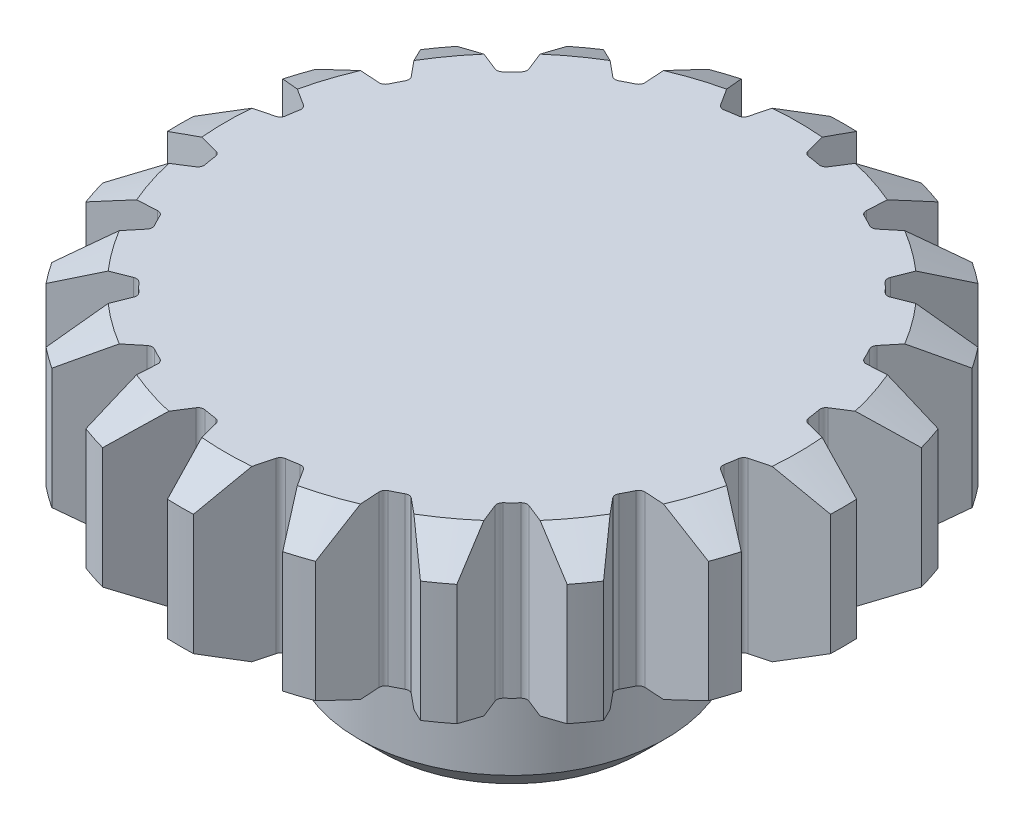
from build123d import *

# Parameters (mm, degrees)
EXTRUDE_1_DEPTH = 5.5
SKETCH_3_R      = 5
EXTRUDE_2_DEPTH = 5.5
FILLET_1_R      = 2
CHAMFER_1_SIZE  = 0.8


with BuildPart() as part:
    # 草图1 → 凸台-拉伸1 (new body)
    with BuildSketch(Plane(origin=(0, 0, 0), x_dir=(1, 0, 0), z_dir=(0, 1, 0))):
        with BuildLine():
            Line((0.974543631, 8.644214497), (0.423220814, 10.771689011))
            ThreePointArc((0.423220814, 10.771689011), (0, 10.78), (-0.423220814, 10.771689011))
            Line((-0.423220814, 10.771689011), (-0.974543631, 8.644214497))
            ThreePointArc((-0.974543631, 8.644214497), (-1.03427504, 8.546700439), (-1.138258975, 8.499117102))
            ThreePointArc((-1.138258975, 8.499117102), (-1.341425538, 8.469427521), (-1.543823006, 8.434882069))
            ThreePointArc((-1.543823006, 8.434882069), (-1.657421665, 8.44800371), (-1.744363111, 8.522287069))
            Line((-1.744363111, 8.522287069), (-2.92612805, 10.375267449))
            ThreePointArc((-2.92612805, 10.375267449), (-3.331203199, 10.252389246), (-3.731141875, 10.113702601))
            Line((-3.731141875, 10.113702601), (-3.598055254, 7.919985981))
            ThreePointArc((-3.598055254, 7.919985981), (-3.624729698, 7.808786581), (-3.708920237, 7.731399335))
            ThreePointArc((-3.708920237, 7.731399335), (-3.892968535, 7.640380945), (-4.074784835, 7.544982011))
            ThreePointArc((-4.074784835, 7.544982011), (-4.186878389, 7.522357517), (-4.292519439, 7.566138805))
            Line((-4.292519439, 7.566138805), (-5.989047112, 8.963242421))
            ThreePointArc((-5.989047112, 8.963242421), (-6.33632502, 8.721203199), (-6.673832774, 8.465716515))
            Line((-6.673832774, 8.465716515), (-5.869364158, 6.420494057))
            ThreePointArc((-5.869364158, 6.420494057), (-5.860370559, 6.306494286), (-5.916526544, 6.206878334))
            ThreePointArc((-5.916526544, 6.206878334), (-6.063440649, 6.063440649), (-6.206878334, 5.916526544))
            ThreePointArc((-6.206878334, 5.916526544), (-6.306494286, 5.860370559), (-6.420494057, 5.869364158))
            Line((-6.420494057, 5.869364158), (-8.465716515, 6.673832774))
            ThreePointArc((-8.465716515, 6.673832774), (-8.721203199, 6.33632502), (-8.963242421, 5.989047112))
            Line((-8.963242421, 5.989047112), (-7.566138805, 4.292519439))
            ThreePointArc((-7.566138805, 4.292519439), (-7.522357517, 4.186878389), (-7.544982011, 4.074784835))
            ThreePointArc((-7.544982011, 4.074784835), (-7.640380945, 3.892968535), (-7.731399335, 3.708920237))
            ThreePointArc((-7.731399335, 3.708920237), (-7.808786581, 3.624729698), (-7.919985981, 3.598055254))
            Line((-7.919985981, 3.598055254), (-10.113702601, 3.731141875))
            ThreePointArc((-10.113702601, 3.731141875), (-10.252389246, 3.331203199), (-10.375267449, 2.92612805))
            Line((-10.375267449, 2.92612805), (-8.522287069, 1.744363111))
            ThreePointArc((-8.522287069, 1.744363111), (-8.44800371, 1.657421665), (-8.434882069, 1.543823006))
            ThreePointArc((-8.434882069, 1.543823006), (-8.469427521, 1.341425538), (-8.499117102, 1.138258975))
            ThreePointArc((-8.499117102, 1.138258975), (-8.546700439, 1.03427504), (-8.644214497, 0.974543631))
            Line((-8.644214497, 0.974543631), (-10.771689011, 0.423220814))
            ThreePointArc((-10.771689011, 0.423220814), (-10.78, 0), (-10.771689011, -0.423220814))
            Line((-10.771689011, -0.423220814), (-8.644214497, -0.974543631))
            ThreePointArc((-8.644214497, -0.974543631), (-8.546700439, -1.03427504), (-8.499117102, -1.138258975))
            ThreePointArc((-8.499117102, -1.138258975), (-8.469427521, -1.341425538), (-8.434882069, -1.543823006))
            ThreePointArc((-8.434882069, -1.543823006), (-8.44800371, -1.657421665), (-8.522287069, -1.744363111))
            Line((-8.522287069, -1.744363111), (-10.375267449, -2.92612805))
            ThreePointArc((-10.375267449, -2.92612805), (-10.252389246, -3.331203199), (-10.113702601, -3.731141875))
            Line((-10.113702601, -3.731141875), (-7.919985981, -3.598055254))
            ThreePointArc((-7.919985981, -3.598055254), (-7.808786581, -3.624729698), (-7.731399335, -3.708920237))
            ThreePointArc((-7.731399335, -3.708920237), (-7.640380945, -3.892968535), (-7.544982011, -4.074784835))
            ThreePointArc((-7.544982011, -4.074784835), (-7.522357517, -4.186878389), (-7.566138805, -4.292519439))
            Line((-7.566138805, -4.292519439), (-8.963242421, -5.989047112))
            ThreePointArc((-8.963242421, -5.989047112), (-8.721203199, -6.33632502), (-8.465716515, -6.673832774))
            Line((-8.465716515, -6.673832774), (-6.420494057, -5.869364158))
            ThreePointArc((-6.420494057, -5.869364158), (-6.306494286, -5.860370559), (-6.206878334, -5.916526544))
            ThreePointArc((-6.206878334, -5.916526544), (-6.063440649, -6.063440649), (-5.916526544, -6.206878334))
            ThreePointArc((-5.916526544, -6.206878334), (-5.860370559, -6.306494286), (-5.869364158, -6.420494057))
            Line((-5.869364158, -6.420494057), (-6.673832774, -8.465716515))
            ThreePointArc((-6.673832774, -8.465716515), (-6.33632502, -8.721203199), (-5.989047112, -8.963242421))
            Line((-5.989047112, -8.963242421), (-4.292519439, -7.566138805))
            ThreePointArc((-4.292519439, -7.566138805), (-4.186878389, -7.522357517), (-4.074784835, -7.544982011))
            ThreePointArc((-4.074784835, -7.544982011), (-3.892968535, -7.640380945), (-3.708920237, -7.731399335))
            ThreePointArc((-3.708920237, -7.731399335), (-3.624729698, -7.808786581), (-3.598055254, -7.919985981))
            Line((-3.598055254, -7.919985981), (-3.731141875, -10.113702601))
            ThreePointArc((-3.731141875, -10.113702601), (-3.331203199, -10.252389246), (-2.92612805, -10.375267449))
            Line((-2.92612805, -10.375267449), (-1.744363111, -8.522287069))
            ThreePointArc((-1.744363111, -8.522287069), (-1.657421665, -8.44800371), (-1.543823006, -8.434882069))
            ThreePointArc((-1.543823006, -8.434882069), (-1.341425538, -8.469427521), (-1.138258975, -8.499117102))
            ThreePointArc((-1.138258975, -8.499117102), (-1.03427504, -8.546700439), (-0.974543631, -8.644214497))
            Line((-0.974543631, -8.644214497), (-0.423220814, -10.771689011))
            ThreePointArc((-0.423220814, -10.771689011), (0, -10.78), (0.423220814, -10.771689011))
            Line((0.423220814, -10.771689011), (0.974543631, -8.644214497))
            ThreePointArc((0.974543631, -8.644214497), (1.03427504, -8.546700439), (1.138258975, -8.499117102))
            ThreePointArc((1.138258975, -8.499117102), (1.341425538, -8.469427521), (1.543823006, -8.434882069))
            ThreePointArc((1.543823006, -8.434882069), (1.657421665, -8.44800371), (1.744363111, -8.522287069))
            Line((1.744363111, -8.522287069), (2.92612805, -10.375267449))
            ThreePointArc((2.92612805, -10.375267449), (3.331203199, -10.252389246), (3.731141875, -10.113702601))
            Line((3.731141875, -10.113702601), (3.598055254, -7.919985981))
            ThreePointArc((3.598055254, -7.919985981), (3.624729698, -7.808786581), (3.708920237, -7.731399335))
            ThreePointArc((3.708920237, -7.731399335), (3.892968535, -7.640380945), (4.074784835, -7.544982011))
            ThreePointArc((4.074784835, -7.544982011), (4.186878389, -7.522357517), (4.292519439, -7.566138805))
            Line((4.292519439, -7.566138805), (5.989047112, -8.963242421))
            ThreePointArc((5.989047112, -8.963242421), (6.33632502, -8.721203199), (6.673832774, -8.465716515))
            Line((6.673832774, -8.465716515), (5.869364158, -6.420494057))
            ThreePointArc((5.869364158, -6.420494057), (5.860370559, -6.306494286), (5.916526544, -6.206878334))
            ThreePointArc((5.916526544, -6.206878334), (6.063440649, -6.063440649), (6.206878334, -5.916526544))
            ThreePointArc((6.206878334, -5.916526544), (6.306494286, -5.860370559), (6.420494057, -5.869364158))
            Line((6.420494057, -5.869364158), (8.465716515, -6.673832774))
            ThreePointArc((8.465716515, -6.673832774), (8.721203199, -6.33632502), (8.963242421, -5.989047112))
            Line((8.963242421, -5.989047112), (7.566138805, -4.292519439))
            ThreePointArc((7.566138805, -4.292519439), (7.522357517, -4.186878389), (7.544982011, -4.074784835))
            ThreePointArc((7.544982011, -4.074784835), (7.640380945, -3.892968535), (7.731399335, -3.708920237))
            ThreePointArc((7.731399335, -3.708920237), (7.808786581, -3.624729698), (7.919985981, -3.598055254))
            Line((7.919985981, -3.598055254), (10.113702601, -3.731141875))
            ThreePointArc((10.113702601, -3.731141875), (10.252389246, -3.331203199), (10.375267449, -2.92612805))
            Line((10.375267449, -2.92612805), (8.522287069, -1.744363111))
            ThreePointArc((8.522287069, -1.744363111), (8.44800371, -1.657421665), (8.434882069, -1.543823006))
            ThreePointArc((8.434882069, -1.543823006), (8.469427521, -1.341425538), (8.499117102, -1.138258975))
            ThreePointArc((8.499117102, -1.138258975), (8.546700439, -1.03427504), (8.644214497, -0.974543631))
            Line((8.644214497, -0.974543631), (10.771689011, -0.423220814))
            ThreePointArc((10.771689011, -0.423220814), (10.78, 0), (10.771689011, 0.423220814))
            Line((10.771689011, 0.423220814), (8.644214497, 0.974543631))
            ThreePointArc((8.644214497, 0.974543631), (8.546700439, 1.03427504), (8.499117102, 1.138258975))
            ThreePointArc((8.499117102, 1.138258975), (8.469427521, 1.341425538), (8.434882069, 1.543823006))
            ThreePointArc((8.434882069, 1.543823006), (8.44800371, 1.657421665), (8.522287069, 1.744363111))
            Line((8.522287069, 1.744363111), (10.375267449, 2.92612805))
            ThreePointArc((10.375267449, 2.92612805), (10.252389246, 3.331203199), (10.113702601, 3.731141875))
            Line((10.113702601, 3.731141875), (7.919985981, 3.598055254))
            ThreePointArc((7.919985981, 3.598055254), (7.808786581, 3.624729698), (7.731399335, 3.708920237))
            ThreePointArc((7.731399335, 3.708920237), (7.640380945, 3.892968535), (7.544982011, 4.074784835))
            ThreePointArc((7.544982011, 4.074784835), (7.522357517, 4.186878389), (7.566138805, 4.292519439))
            Line((7.566138805, 4.292519439), (8.963242421, 5.989047112))
            ThreePointArc((8.963242421, 5.989047112), (8.721203199, 6.33632502), (8.465716515, 6.673832774))
            Line((8.465716515, 6.673832774), (6.420494057, 5.869364158))
            ThreePointArc((6.420494057, 5.869364158), (6.306494286, 5.860370559), (6.206878334, 5.916526544))
            ThreePointArc((6.206878334, 5.916526544), (6.063440649, 6.063440649), (5.916526544, 6.206878334))
            ThreePointArc((5.916526544, 6.206878334), (5.860370559, 6.306494286), (5.869364158, 6.420494057))
            Line((5.869364158, 6.420494057), (6.673832774, 8.465716515))
            ThreePointArc((6.673832774, 8.465716515), (6.33632502, 8.721203199), (5.989047112, 8.963242421))
            Line((5.989047112, 8.963242421), (4.292519439, 7.566138805))
            ThreePointArc((4.292519439, 7.566138805), (4.186878389, 7.522357517), (4.074784835, 7.544982011))
            ThreePointArc((4.074784835, 7.544982011), (3.892968535, 7.640380945), (3.708920237, 7.731399335))
            ThreePointArc((3.708920237, 7.731399335), (3.624729698, 7.808786581), (3.598055254, 7.919985981))
            Line((3.598055254, 7.919985981), (3.731141875, 10.113702601))
            ThreePointArc((3.731141875, 10.113702601), (3.331203199, 10.252389246), (2.92612805, 10.375267449))
            Line((2.92612805, 10.375267449), (1.744363111, 8.522287069))
            ThreePointArc((1.744363111, 8.522287069), (1.657421665, 8.44800371), (1.543823006, 8.434882069))
            ThreePointArc((1.543823006, 8.434882069), (1.341425538, 8.469427521), (1.138258975, 8.499117102))
            ThreePointArc((1.138258975, 8.499117102), (1.03427504, 8.546700439), (0.974543631, 8.644214497))
        make_face()
    extrude(amount=EXTRUDE_1_DEPTH)

    # 草图3 → 凸台-拉伸2 (add)
    with BuildSketch(Plane.XZ):
        with Locations(Location((2.0683e-05, -0.000116926, 0), (0, 0, 90))):
            Circle(SKETCH_3_R)
        with BuildLine():
            ThreePointArc((-0.726510583, 3.178353385), (-0.810978772, 3.157861734), (-0.894870739, 3.135125845))
            add(Edge.make_bspline(
                [(-0.894870739, 3.135125845), (-0.91150588, 3.066389051), (-0.929817867, 2.961578998), (-0.934870558, 2.837743378), (-0.931459517, 2.767068936), (-0.923842486, 2.714542165), (-0.916798237, 2.661791105), (-0.921901567, 2.608443484), (-0.940663745, 2.567277049), (-0.966114589, 2.542161109), (-0.981714859, 2.53342471), (-0.989961183, 2.53019119)],
                knots=[0, 0, 0, 0, 0.333125, 0.4996875, 0.58296875, 0.66625, 0.7496875, 0.833125, 0.9165625, 0.95828125, 1, 1, 1, 1], degree=3, weights=[1, 1, 1, 1, 1, 1, 1, 1, 1, 1, 1, 1]))
            ThreePointArc((-0.989961183, 2.53019119), (-1.000341723, 2.526105875), (-1.010705402, 2.521977973))
            add(Edge.make_bspline(
                [(-1.010705402, 2.521977973), (-1.01893021, 2.518690111), (-1.036282794, 2.514379551), (-1.072028705, 2.515265982), (-1.113886108, 2.532431427), (-1.154125235, 2.567826699), (-1.185095033, 2.611094915), (-1.215505257, 2.654607272), (-1.261398699, 2.708461741), (-1.349853267, 2.795275218), (-1.43494955, 2.859143041), (-1.49412962, 2.897862469)],
                knots=[0, 0, 0, 0, 0.041733903, 0.083467806, 0.166935612, 0.250403418, 0.333871224, 0.417137321, 0.500403418, 0.666935612, 1, 1, 1, 1], degree=3, weights=[1, 1, 1, 1, 1, 1, 1, 1, 1, 1, 1, 1]))
            ThreePointArc((-1.49412962, 2.897862469), (-1.570848019, 2.857008217), (-1.646450179, 2.814123533))
            add(Edge.make_bspline(
                [(-1.646450179, 2.814123533), (-1.645468552, 2.743409241), (-1.637140033, 2.637337982), (-1.611237319, 2.516136333), (-1.590357422, 2.44853055), (-1.569916818, 2.399548283), (-1.549975222, 2.350206327), (-1.541651207, 2.297265573), (-1.549586261, 2.252726494), (-1.567991439, 2.22207025), (-1.580928945, 2.209728692), (-1.588112051, 2.204545981)],
                knots=[0, 0, 0, 0, 0.333125, 0.4996875, 0.58296875, 0.66625, 0.7496875, 0.833125, 0.9165625, 0.95828125, 1, 1, 1, 1], degree=3, weights=[1, 1, 1, 1, 1, 1, 1, 1, 1, 1, 1, 1]))
            ThreePointArc((-1.588112051, 2.204545981), (-1.597150491, 2.198007479), (-1.606162008, 2.19143192))
            add(Edge.make_bspline(
                [(-1.606162008, 2.19143192), (-1.613310761, 2.186201925), (-1.629046189, 2.177711378), (-1.663889523, 2.169680313), (-1.708700771, 2.175896961), (-1.756478158, 2.200173162), (-1.797235351, 2.234380152), (-1.837511264, 2.268962773), (-1.895355942, 2.30971207), (-2.002621181, 2.371800385), (-2.100927289, 2.412499098), (-2.167877238, 2.435284599)],
                knots=[0, 0, 0, 0, 0.041733903, 0.083467806, 0.166935612, 0.250403418, 0.333871224, 0.417137321, 0.500403418, 0.666935612, 1, 1, 1, 1], degree=3, weights=[1, 1, 1, 1, 1, 1, 1, 1, 1, 1, 1, 1]))
            ThreePointArc((-2.167877238, 2.435284599), (-2.232025348, 2.376634768), (-2.29458734, 2.316295893))
            add(Edge.make_bspline(
                [(-2.29458734, 2.316295893), (-2.276050624, 2.248047341), (-2.241604911, 2.147379724), (-2.186374354, 2.036427591), (-2.149337563, 1.976138387), (-2.117357744, 1.93377836), (-2.085771804, 1.890945845), (-2.064543473, 1.841738421), (-2.061152814, 1.796625251), (-2.071355862, 1.762354948), (-2.080817691, 1.747183696), (-2.08648624, 1.740377444)],
                knots=[0, 0, 0, 0, 0.333125, 0.4996875, 0.58296875, 0.66625, 0.7496875, 0.833125, 0.9165625, 0.95828125, 1, 1, 1, 1], degree=3, weights=[1, 1, 1, 1, 1, 1, 1, 1, 1, 1, 1, 1]))
            ThreePointArc((-2.08648624, 1.740377444), (-2.093614661, 1.731796591), (-2.10070779, 1.723186543))
            add(Edge.make_bspline(
                [(-2.10070779, 1.723186543), (-2.106331304, 1.716343035), (-2.119460862, 1.704205992), (-2.151212284, 1.687762054), (-2.196161721, 1.68263929), (-2.248475339, 1.694271056), (-2.296459003, 1.717267469), (-2.344069922, 1.740747401), (-2.410231241, 1.765831098), (-2.529567282, 1.799293014), (-2.634906281, 1.814265367), (-2.705419398, 1.819685245)],
                knots=[0, 0, 0, 0, 0.041733903, 0.083467806, 0.166935612, 0.250403418, 0.333871224, 0.417137321, 0.500403418, 0.666935612, 1, 1, 1, 1], degree=3, weights=[1, 1, 1, 1, 1, 1, 1, 1, 1, 1, 1, 1]))
            ThreePointArc((-2.705419398, 1.819685245), (-2.752966557, 1.74692502), (-2.798557381, 1.672923266))
            add(Edge.make_bspline(
                [(-2.798557381, 1.672923266), (-2.763630305, 1.611428763), (-2.70523175, 1.522490104), (-2.624143688, 1.428759017), (-2.573277161, 1.379574585), (-2.531767536, 1.346498433), (-2.490521914, 1.312866685), (-2.457723121, 1.270484473), (-2.443219797, 1.22763184), (-2.44457962, 1.191900806), (-2.449971251, 1.174853125), (-2.453769065, 1.166850993)],
                knots=[0, 0, 0, 0, 0.333125, 0.4996875, 0.58296875, 0.66625, 0.7496875, 0.833125, 0.9165625, 0.95828125, 1, 1, 1, 1], degree=3, weights=[1, 1, 1, 1, 1, 1, 1, 1, 1, 1, 1, 1]))
            ThreePointArc((-2.453769065, 1.166850993), (-2.458539563, 1.156766958), (-2.463268616, 1.146663421))
            add(Edge.make_bspline(
                [(-2.463268616, 1.146663421), (-2.467013546, 1.138636403), (-2.476712255, 1.12361548), (-2.503376706, 1.0997919), (-2.545639995, 1.083651607), (-2.599202787, 1.081908072), (-2.651397931, 1.092248958), (-2.703352287, 1.103150871), (-2.773673088, 1.110992866), (-2.897581608, 1.113725848), (-3.003334662, 1.102031074), (-3.072980348, 1.089744777)],
                knots=[0, 0, 0, 0, 0.041733903, 0.083467806, 0.166935612, 0.250403418, 0.333871224, 0.417137321, 0.500403418, 0.666935612, 1, 1, 1, 1], degree=3, weights=[1, 1, 1, 1, 1, 1, 1, 1, 1, 1, 1, 1]))
            ThreePointArc((-3.072980348, 1.089744777), (-3.100938994, 1.00744595), (-3.126694011, 0.924431121))
            add(Edge.make_bspline(
                [(-3.126694011, 0.924431121), (-3.077571172, 0.873554591), (-2.99888917, 0.801933234), (-2.897038665, 0.731312662), (-2.835538533, 0.69632344), (-2.787107304, 0.674609461), (-2.738793613, 0.652291685), (-2.696485228, 0.619397717), (-2.671780536, 0.581498207), (-2.66421169, 0.546551555), (-2.665194347, 0.528698615), (-2.666882797, 0.520003406)],
                knots=[0, 0, 0, 0, 0.333125, 0.4996875, 0.58296875, 0.66625, 0.7496875, 0.833125, 0.9165625, 0.95828125, 1, 1, 1, 1], degree=3, weights=[1, 1, 1, 1, 1, 1, 1, 1, 1, 1, 1, 1]))
            ThreePointArc((-2.666882797, 0.520003406), (-2.668995623, 0.509049805), (-2.671063457, 0.498087622))
            add(Edge.make_bspline(
                [(-2.671063457, 0.498087622), (-2.672694496, 0.489381461), (-2.678352949, 0.472420477), (-2.698255005, 0.44271418), (-2.735176587, 0.416570511), (-2.786623006, 0.401561228), (-2.839750017, 0.398596831), (-2.892783327, 0.396235717), (-2.962845096, 0.38634327), (-3.083540467, 0.358175595), (-3.183062722, 0.320548518), (-3.247464883, 0.291328039)],
                knots=[0, 0, 0, 0, 0.041733903, 0.083467806, 0.166935612, 0.250403418, 0.333871224, 0.417137321, 0.500403418, 0.666935612, 1, 1, 1, 1], degree=3, weights=[1, 1, 1, 1, 1, 1, 1, 1, 1, 1, 1, 1]))
            ThreePointArc((-3.247464883, 0.291328039), (-3.254078271, 0.204661749), (-3.258379198, 0.117849972))
            add(Edge.make_bspline(
                [(-3.258379198, 0.117849972), (-3.198147164, 0.080788175), (-3.104125595, 0.030984352), (-2.987912289, -0.012088354), (-2.919642831, -0.030683864), (-2.867333111, -0.039671302), (-2.814987079, -0.049272797), (-2.765827492, -0.070611674), (-2.732473718, -0.101176693), (-2.716451783, -0.133143137), (-2.712963722, -0.150679571), (-2.712436716, -0.159521504)],
                knots=[0, 0, 0, 0, 0.333125, 0.4996875, 0.58296875, 0.66625, 0.7496875, 0.833125, 0.9165625, 0.95828125, 1, 1, 1, 1], degree=3, weights=[1, 1, 1, 1, 1, 1, 1, 1, 1, 1, 1, 1]))
            ThreePointArc((-2.712436716, -0.159521504), (-2.711759114, -0.170656416), (-2.711035799, -0.181788452))
            add(Edge.make_bspline(
                [(-2.711035799, -0.181788452), (-2.710450461, -0.190626715), (-2.711713119, -0.208462039), (-2.723602259, -0.242184498), (-2.752862215, -0.27668884), (-2.798959694, -0.304020783), (-2.849680407, -0.320104197), (-2.900460393, -0.335579981), (-2.965860891, -0.362585292), (-3.075759378, -0.419883746), (-3.162797486, -0.481078878), (-3.217909497, -0.525397507)],
                knots=[0, 0, 0, 0, 0.041733903, 0.083467806, 0.166935612, 0.250403418, 0.333871224, 0.417137321, 0.500403418, 0.666935612, 1, 1, 1, 1], degree=3, weights=[1, 1, 1, 1, 1, 1, 1, 1, 1, 1, 1, 1]))
            ThreePointArc((-3.217909497, -0.525397507), (-3.202762083, -0.610985699), (-3.185338677, -0.696139722))
            add(Edge.make_bspline(
                [(-3.185338677, -0.696139722), (-3.11778205, -0.717058057), (-3.014328634, -0.741914987), (-2.891054636, -0.754733411), (-2.820305473, -0.755766785), (-2.767404075, -0.751462968), (-2.714314794, -0.747744886), (-2.661392883, -0.75618787), (-2.621485769, -0.777497887), (-2.598017461, -0.804475553), (-2.59027785, -0.820593602), (-2.587568502, -0.829026688)],
                knots=[0, 0, 0, 0, 0.333125, 0.4996875, 0.58296875, 0.66625, 0.7496875, 0.833125, 0.9165625, 0.95828125, 1, 1, 1, 1], degree=3, weights=[1, 1, 1, 1, 1, 1, 1, 1, 1, 1, 1, 1]))
            ThreePointArc((-2.587568502, -0.829026688), (-2.584143048, -0.839643264), (-2.580674032, -0.850245685))
            add(Edge.make_bspline(
                [(-2.580674032, -0.850245685), (-2.577909097, -0.85866071), (-2.574696621, -0.876249715), (-2.577825808, -0.91186943), (-2.597585628, -0.95256641), (-2.635437692, -0.990503646), (-2.680565138, -1.018695499), (-2.725901106, -1.046313552), (-2.782530979, -1.088734884), (-2.874727258, -1.171563844), (-2.943812292, -1.252481915), (-2.986171263, -1.309113993)],
                knots=[0, 0, 0, 0, 0.041733903, 0.083467806, 0.166935612, 0.250403418, 0.333871224, 0.417137321, 0.500403418, 0.666935612, 1, 1, 1, 1], degree=3, weights=[1, 1, 1, 1, 1, 1, 1, 1, 1, 1, 1, 1]))
            ThreePointArc((-2.986171263, -1.309113993), (-2.950214816, -1.388246266), (-2.912161854, -1.466391994))
            add(Edge.make_bspline(
                [(-2.912161854, -1.466391994), (-2.841525464, -1.469852491), (-2.73514056, -1.468200676), (-2.612551629, -1.449959389), (-2.543768192, -1.433365697), (-2.493599104, -1.416041049), (-2.44310237, -1.39923701), (-2.389743413, -1.394253599), (-2.345790468, -1.404969626), (-2.316350388, -1.425263408), (-2.304845536, -1.438950317), (-2.300124083, -1.446444674)],
                knots=[0, 0, 0, 0, 0.333125, 0.4996875, 0.58296875, 0.66625, 0.7496875, 0.833125, 0.9165625, 0.95828125, 1, 1, 1, 1], degree=3, weights=[1, 1, 1, 1, 1, 1, 1, 1, 1, 1, 1, 1]))
            ThreePointArc((-2.300124083, -1.446444674), (-2.294166011, -1.455875835), (-2.288169266, -1.465282452))
            add(Edge.make_bspline(
                [(-2.288169266, -1.465282452), (-2.283398465, -1.472745493), (-2.275912707, -1.488982996), (-2.270085321, -1.52426185), (-2.279103423, -1.568594326), (-2.306331688, -1.61475312), (-2.343030343, -1.653282014), (-2.380073669, -1.691306991), (-2.424374654, -1.746478855), (-2.493075692, -1.849633874), (-2.539866787, -1.945190504), (-2.566811148, -2.010577629)],
                knots=[0, 0, 0, 0, 0.041733903, 0.083467806, 0.166935612, 0.250403418, 0.333871224, 0.417137321, 0.500403418, 0.666935612, 1, 1, 1, 1], degree=3, weights=[1, 1, 1, 1, 1, 1, 1, 1, 1, 1, 1, 1]))
            ThreePointArc((-2.566811148, -2.010577629), (-2.512304942, -2.078281811), (-2.456013432, -2.144509061))
            add(Edge.make_bspline(
                [(-2.456013432, -2.144509061), (-2.386735623, -2.130294284), (-2.284103787, -2.102237514), (-2.169902636, -2.054082684), (-2.10740684, -2.020904567), (-2.063122371, -1.991647661), (-2.01839108, -1.962813524), (-1.967947817, -1.944716843), (-1.922710767, -1.944165554), (-1.889148742, -1.956500319), (-1.87460154, -1.966896088), (-1.86816465, -1.972980819)],
                knots=[0, 0, 0, 0, 0.333125, 0.4996875, 0.58296875, 0.66625, 0.7496875, 0.833125, 0.9165625, 0.95828125, 1, 1, 1, 1], degree=3, weights=[1, 1, 1, 1, 1, 1, 1, 1, 1, 1, 1, 1]))
            ThreePointArc((-1.86816465, -1.972980819), (-1.860048327, -1.98063397), (-1.85190065, -1.988253731))
            add(Edge.make_bspline(
                [(-1.85190065, -1.988253731), (-1.84542375, -1.994295856), (-1.834135069, -2.008161597), (-1.819717267, -2.040882888), (-1.81742701, -2.086065289), (-1.832320623, -2.137545314), (-1.858284577, -2.183990336), (-1.884707691, -2.230032989), (-1.913896194, -2.294488735), (-1.954785253, -2.411488202), (-1.976342352, -2.515679217), (-1.98617909, -2.585712876)],
                knots=[0, 0, 0, 0, 0.041733903, 0.083467806, 0.166935612, 0.250403418, 0.333871224, 0.417137321, 0.500403418, 0.666935612, 1, 1, 1, 1], degree=3, weights=[1, 1, 1, 1, 1, 1, 1, 1, 1, 1, 1, 1]))
            ThreePointArc((-1.98617909, -2.585712876), (-1.916547951, -2.637734864), (-1.845554895, -2.687882333))
            add(Edge.make_bspline(
                [(-1.845554895, -2.687882333), (-1.781988647, -2.656885449), (-1.689558613, -2.604186635), (-1.590920922, -2.529144006), (-1.538639608, -2.481466168), (-1.503022314, -2.442115322), (-1.466867096, -2.403062843), (-1.422509063, -2.372989973), (-1.378830318, -2.361206007), (-1.343255175, -2.364806716), (-1.326579677, -2.371258141), (-1.318831803, -2.375550919)],
                knots=[0, 0, 0, 0, 0.333125, 0.4996875, 0.58296875, 0.66625, 0.7496875, 0.833125, 0.9165625, 0.95828125, 1, 1, 1, 1], degree=3, weights=[1, 1, 1, 1, 1, 1, 1, 1, 1, 1, 1, 1]))
            ThreePointArc((-1.318831803, -2.375550919), (-1.309067208, -2.380945185), (-1.299280547, -2.386299313))
            add(Edge.make_bspline(
                [(-1.299280547, -2.386299313), (-1.291504516, -2.390540874), (-1.277122219, -2.401163616), (-1.255019925, -2.429271346), (-1.241565214, -2.472464695), (-1.243188356, -2.526031271), (-1.256786197, -2.57747411), (-1.270928838, -2.62864141), (-1.283170839, -2.698331046), (-1.293678708, -2.821823455), (-1.2886473, -2.92810215), (-1.280758336, -2.99838187)],
                knots=[0, 0, 0, 0, 0.041733903, 0.083467806, 0.166935612, 0.250403418, 0.333871224, 0.417137321, 0.500403418, 0.666935612, 1, 1, 1, 1], degree=3, weights=[1, 1, 1, 1, 1, 1, 1, 1, 1, 1, 1, 1]))
            ThreePointArc((-1.280758336, -2.99838187), (-1.200377445, -3.031452932), (-1.119143598, -3.062369671))
            add(Edge.make_bspline(
                [(-1.119143598, -3.062369671), (-1.065283012, -3.016538328), (-0.9888625, -2.942508729), (-0.911986036, -2.845293506), (-0.873204232, -2.786111721), (-0.848492078, -2.739139493), (-0.823184699, -2.692322483), (-0.787699074, -2.652163013), (-0.74832313, -2.629886799), (-0.712970185, -2.624527207), (-0.695214175, -2.626628921), (-0.686642144, -2.628860016)],
                knots=[0, 0, 0, 0, 0.333125, 0.4996875, 0.58296875, 0.66625, 0.7496875, 0.833125, 0.9165625, 0.95828125, 1, 1, 1, 1], degree=3, weights=[1, 1, 1, 1, 1, 1, 1, 1, 1, 1, 1, 1]))
            ThreePointArc((-0.686642144, -2.628860016), (-0.675842822, -2.631656455), (-0.66503211, -2.63440853))
            add(Edge.make_bspline(
                [(-0.66503211, -2.63440853), (-0.656445544, -2.636583014), (-0.639873325, -2.643295291), (-0.611475307, -2.665023348), (-0.587701552, -2.703513648), (-0.575952233, -2.755800991), (-0.576329559, -2.809009304), (-0.577303093, -2.86208622), (-0.571829382, -2.93263089), (-0.551295814, -3.054856759), (-0.519992039, -3.156545254), (-0.494873066, -3.222655101)],
                knots=[0, 0, 0, 0, 0.041733903, 0.083467806, 0.166935612, 0.250403418, 0.333871224, 0.417137321, 0.500403418, 0.666935612, 1, 1, 1, 1], degree=3, weights=[1, 1, 1, 1, 1, 1, 1, 1, 1, 1, 1, 1]))
            ThreePointArc((-0.494873066, -3.222655101), (-0.40879305, -3.23469726), (-0.322422633, -3.244440656))
            add(Edge.make_bspline(
                [(-0.322422633, -3.244440656), (-0.281651968, -3.186654607), (-0.226042783, -3.095945779), (-0.175757923, -2.982666342), (-0.152912517, -2.915699235), (-0.140657997, -2.864057016), (-0.127789598, -2.812417334), (-0.103402396, -2.764693977), (-0.070814825, -2.733327248), (-0.037882114, -2.719339969), (-0.020208744, -2.71696836), (-0.011351167, -2.716997583)],
                knots=[0, 0, 0, 0, 0.333125, 0.4996875, 0.58296875, 0.66625, 0.7496875, 0.833125, 0.9165625, 0.95828125, 1, 1, 1, 1], degree=3, weights=[1, 1, 1, 1, 1, 1, 1, 1, 1, 1, 1, 1]))
            ThreePointArc((-0.011351167, -2.716997583), (-0.000162985, -2.717020619), (0.011025198, -2.716997583))
            add(Edge.make_bspline(
                [(0.011025198, -2.716997583), (0.019882774, -2.71696836), (0.037556135, -2.719339969), (0.07048885, -2.733327248), (0.10307642, -2.764693977), (0.127463622, -2.812417334), (0.140329535, -2.864047672), (0.152586541, -2.915699235), (0.175431947, -2.982666342), (0.225716807, -3.095945779), (0.281325992, -3.186654607), (0.322096657, -3.244440656)],
                knots=[0, 0, 0, 0, 0.041733903, 0.083467806, 0.166935612, 0.250403418, 0.333871224, 0.417137321, 0.500403418, 0.666935612, 1, 1, 1, 1], degree=3, weights=[1, 1, 1, 1, 1, 1, 1, 1, 1, 1, 1, 1]))
            ThreePointArc((0.322096657, -3.244440656), (0.408467074, -3.23469726), (0.49454709, -3.2226551))
            add(Edge.make_bspline(
                [(0.49454709, -3.2226551), (0.519666063, -3.156545254), (0.550969837, -3.054856759), (0.571503405, -2.93263089), (0.576977117, -2.86208622), (0.576003499, -2.809018972), (0.575626257, -2.755800991), (0.587375575, -2.703513648), (0.611149331, -2.665023348), (0.639547349, -2.643295291), (0.656119567, -2.636583014), (0.664706134, -2.63440853)],
                knots=[0, 0, 0, 0, 0.333125, 0.4996875, 0.58296875, 0.66625, 0.7496875, 0.833125, 0.9165625, 0.95828125, 1, 1, 1, 1], degree=3, weights=[1, 1, 1, 1, 1, 1, 1, 1, 1, 1, 1, 1]))
            ThreePointArc((0.664706134, -2.63440853), (0.675516846, -2.631656455), (0.686316168, -2.628860016))
            add(Edge.make_bspline(
                [(0.686316168, -2.628860016), (0.694888199, -2.626628921), (0.712644209, -2.624527207), (0.747997154, -2.629886799), (0.787373098, -2.652163013), (0.822858723, -2.692322483), (0.84816137, -2.739131061), (0.872878255, -2.786111721), (0.911660059, -2.845293506), (0.988536524, -2.942508729), (1.064957036, -3.016538328), (1.118817622, -3.062369671)],
                knots=[0, 0, 0, 0, 0.041733903, 0.083467806, 0.166935612, 0.250403418, 0.333871224, 0.417137321, 0.500403418, 0.666935612, 1, 1, 1, 1], degree=3, weights=[1, 1, 1, 1, 1, 1, 1, 1, 1, 1, 1, 1]))
            ThreePointArc((1.118817622, -3.062369671), (1.200051469, -3.031452932), (1.280432359, -2.99838187))
            add(Edge.make_bspline(
                [(1.280432359, -2.99838187), (1.288321324, -2.92810215), (1.293352732, -2.821823455), (1.282844863, -2.698331046), (1.270602862, -2.62864141), (1.256462544, -2.577483495), (1.24286238, -2.526031271), (1.241239238, -2.472464695), (1.254693949, -2.429271346), (1.276796243, -2.401163616), (1.291178539, -2.390540874), (1.298954571, -2.386299313)],
                knots=[0, 0, 0, 0, 0.333125, 0.4996875, 0.58296875, 0.66625, 0.7496875, 0.833125, 0.9165625, 0.95828125, 1, 1, 1, 1], degree=3, weights=[1, 1, 1, 1, 1, 1, 1, 1, 1, 1, 1, 1]))
            ThreePointArc((1.298954571, -2.386299313), (1.308741232, -2.380945185), (1.318505826, -2.375550919))
            add(Edge.make_bspline(
                [(1.318505826, -2.375550919), (1.326253701, -2.371258141), (1.342929199, -2.364806716), (1.378504342, -2.361206007), (1.422183087, -2.372989973), (1.46654112, -2.403062843), (1.502689658, -2.442108331), (1.538313632, -2.481466168), (1.590594945, -2.529144006), (1.689232637, -2.604186635), (1.781662671, -2.656885449), (1.845228919, -2.687882333)],
                knots=[0, 0, 0, 0, 0.041733903, 0.083467806, 0.166935612, 0.250403418, 0.333871224, 0.417137321, 0.500403418, 0.666935612, 1, 1, 1, 1], degree=3, weights=[1, 1, 1, 1, 1, 1, 1, 1, 1, 1, 1, 1]))
            ThreePointArc((1.845228919, -2.687882333), (1.916221975, -2.637734864), (1.985853114, -2.585712876))
            add(Edge.make_bspline(
                [(1.985853114, -2.585712876), (1.976016376, -2.515679217), (1.954459277, -2.411488202), (1.913570218, -2.294488735), (1.884381714, -2.230032989), (1.857963185, -2.183998849), (1.831994647, -2.137545314), (1.817101034, -2.086065289), (1.819391291, -2.040882888), (1.833809092, -2.008161597), (1.845097774, -1.994295856), (1.851574674, -1.988253731)],
                knots=[0, 0, 0, 0, 0.333125, 0.4996875, 0.58296875, 0.66625, 0.7496875, 0.833125, 0.9165625, 0.95828125, 1, 1, 1, 1], degree=3, weights=[1, 1, 1, 1, 1, 1, 1, 1, 1, 1, 1, 1]))
            ThreePointArc((1.851574674, -1.988253731), (1.859722351, -1.98063397), (1.867838674, -1.972980819))
            add(Edge.make_bspline(
                [(1.867838674, -1.972980819), (1.874275564, -1.966896088), (1.888822766, -1.956500319), (1.922384791, -1.944165554), (1.967621841, -1.944716843), (2.018065104, -1.962813524), (2.062788187, -1.991642551), (2.107080864, -2.020904567), (2.16957666, -2.054082684), (2.283777811, -2.102237514), (2.386409647, -2.130294284), (2.455687456, -2.144509061)],
                knots=[0, 0, 0, 0, 0.041733903, 0.083467806, 0.166935612, 0.250403418, 0.333871224, 0.417137321, 0.500403418, 0.666935612, 1, 1, 1, 1], degree=3, weights=[1, 1, 1, 1, 1, 1, 1, 1, 1, 1, 1, 1]))
            ThreePointArc((2.455687456, -2.144509061), (2.511978966, -2.078281811), (2.566485172, -2.010577629))
            add(Edge.make_bspline(
                [(2.566485172, -2.010577629), (2.539540811, -1.945190504), (2.492749716, -1.849633874), (2.424048678, -1.746478855), (2.379747693, -1.691306991), (2.342710924, -1.653289119), (2.306005712, -1.61475312), (2.278777447, -1.568594326), (2.269759345, -1.52426185), (2.275586731, -1.488982996), (2.283072489, -1.472745493), (2.287843289, -1.465282452)],
                knots=[0, 0, 0, 0, 0.333125, 0.4996875, 0.58296875, 0.66625, 0.7496875, 0.833125, 0.9165625, 0.95828125, 1, 1, 1, 1], degree=3, weights=[1, 1, 1, 1, 1, 1, 1, 1, 1, 1, 1, 1]))
            ThreePointArc((2.287843289, -1.465282452), (2.293840035, -1.455875835), (2.299798107, -1.446444674))
            add(Edge.make_bspline(
                [(2.299798107, -1.446444674), (2.304519559, -1.438950317), (2.316024412, -1.425263408), (2.345464492, -1.404969626), (2.389417437, -1.394253599), (2.442776394, -1.39923701), (2.493263907, -1.416038142), (2.543442215, -1.433365697), (2.612225653, -1.449959389), (2.734814584, -1.468200676), (2.841199487, -1.469852491), (2.911835878, -1.466391994)],
                knots=[0, 0, 0, 0, 0.041733903, 0.083467806, 0.166935612, 0.250403418, 0.333871224, 0.417137321, 0.500403418, 0.666935612, 1, 1, 1, 1], degree=3, weights=[1, 1, 1, 1, 1, 1, 1, 1, 1, 1, 1, 1]))
            ThreePointArc((2.911835878, -1.466391994), (2.949888839, -1.388246266), (2.985845287, -1.309113993))
            add(Edge.make_bspline(
                [(2.985845287, -1.309113993), (2.943486316, -1.252481915), (2.874401282, -1.171563844), (2.782205003, -1.088734884), (2.72557513, -1.046313552), (2.68024728, -1.018700751), (2.635111715, -0.990503646), (2.597259652, -0.95256641), (2.577499831, -0.91186943), (2.574370645, -0.876249715), (2.577583121, -0.85866071), (2.580348056, -0.850245685)],
                knots=[0, 0, 0, 0, 0.333125, 0.4996875, 0.58296875, 0.66625, 0.7496875, 0.833125, 0.9165625, 0.95828125, 1, 1, 1, 1], degree=3, weights=[1, 1, 1, 1, 1, 1, 1, 1, 1, 1, 1, 1]))
            ThreePointArc((2.580348056, -0.850245685), (2.583817071, -0.839643264), (2.587242526, -0.829026688))
            add(Edge.make_bspline(
                [(2.587242526, -0.829026688), (2.589951874, -0.820593602), (2.597691484, -0.804475552), (2.621159792, -0.777497887), (2.661066907, -0.75618787), (2.713988818, -0.747744886), (2.767068444, -0.751462445), (2.819979497, -0.755766785), (2.89072866, -0.754733411), (3.014002658, -0.741914987), (3.117456073, -0.717058057), (3.185012701, -0.696139722)],
                knots=[0, 0, 0, 0, 0.041733903, 0.083467806, 0.166935612, 0.250403418, 0.333871224, 0.417137321, 0.500403418, 0.666935612, 1, 1, 1, 1], degree=3, weights=[1, 1, 1, 1, 1, 1, 1, 1, 1, 1, 1, 1]))
            ThreePointArc((3.185012701, -0.696139722), (3.202436107, -0.610985699), (3.21758352, -0.525397507))
            add(Edge.make_bspline(
                [(3.21758352, -0.525397507), (3.162471509, -0.481078878), (3.075433402, -0.419883746), (2.965534915, -0.362585292), (2.900134417, -0.335579981), (2.8493636, -0.320107265), (2.798633718, -0.304020783), (2.752536239, -0.27668884), (2.723276283, -0.242184498), (2.711387143, -0.208462039), (2.710124485, -0.190626715), (2.710709823, -0.181788452)],
                knots=[0, 0, 0, 0, 0.333125, 0.4996875, 0.58296875, 0.66625, 0.7496875, 0.833125, 0.9165625, 0.95828125, 1, 1, 1, 1], degree=3, weights=[1, 1, 1, 1, 1, 1, 1, 1, 1, 1, 1, 1]))
            ThreePointArc((2.710709823, -0.181788452), (2.711433138, -0.170656416), (2.71211074, -0.159521504))
            add(Edge.make_bspline(
                [(2.71211074, -0.159521504), (2.712637746, -0.150679571), (2.716125806, -0.133143137), (2.732147742, -0.101176693), (2.765501516, -0.070611674), (2.814661102, -0.049272797), (2.866997654, -0.039673196), (2.919316855, -0.030683864), (2.987586313, -0.012088354), (3.103799619, 0.030984352), (3.197821188, 0.080788175), (3.258053222, 0.117849972)],
                knots=[0, 0, 0, 0, 0.041733903, 0.083467806, 0.166935612, 0.250403418, 0.333871224, 0.417137321, 0.500403418, 0.666935612, 1, 1, 1, 1], degree=3, weights=[1, 1, 1, 1, 1, 1, 1, 1, 1, 1, 1, 1]))
            ThreePointArc((3.258053222, 0.117849972), (3.253752294, 0.204661749), (3.247138907, 0.291328039))
            add(Edge.make_bspline(
                [(3.247138907, 0.291328039), (3.182736746, 0.320548518), (3.083214491, 0.358175595), (2.96251912, 0.38634327), (2.892457351, 0.396235717), (2.839433685, 0.39859614), (2.78629703, 0.401561228), (2.734850611, 0.416570511), (2.697929029, 0.44271418), (2.678026973, 0.472420477), (2.672368519, 0.489381461), (2.670737481, 0.498087622)],
                knots=[0, 0, 0, 0, 0.333125, 0.4996875, 0.58296875, 0.66625, 0.7496875, 0.833125, 0.9165625, 0.95828125, 1, 1, 1, 1], degree=3, weights=[1, 1, 1, 1, 1, 1, 1, 1, 1, 1, 1, 1]))
            ThreePointArc((2.670737481, 0.498087622), (2.668669647, 0.509049805), (2.666556821, 0.520003406))
            add(Edge.make_bspline(
                [(2.666556821, 0.520003406), (2.664868371, 0.528698615), (2.663885714, 0.546551555), (2.671454559, 0.581498207), (2.696159252, 0.619397717), (2.738467637, 0.652291685), (2.786772616, 0.674605268), (2.835212556, 0.69632344), (2.896712689, 0.731312662), (2.998563194, 0.801933234), (3.077245196, 0.873554591), (3.126368035, 0.924431121)],
                knots=[0, 0, 0, 0, 0.041733903, 0.083467806, 0.166935612, 0.250403418, 0.333871224, 0.417137321, 0.500403418, 0.666935612, 1, 1, 1, 1], degree=3, weights=[1, 1, 1, 1, 1, 1, 1, 1, 1, 1, 1, 1]))
            ThreePointArc((3.126368035, 0.924431121), (3.100613018, 1.00744595), (3.072654372, 1.089744777))
            add(Edge.make_bspline(
                [(3.072654372, 1.089744777), (3.003008686, 1.102031074), (2.897255632, 1.113725848), (2.773347112, 1.110992866), (2.703026311, 1.103150871), (2.651081468, 1.092250687), (2.598876811, 1.081908072), (2.545314019, 1.083651607), (2.50305073, 1.0997919), (2.476386279, 1.12361548), (2.46668757, 1.138636403), (2.46294264, 1.146663421)],
                knots=[0, 0, 0, 0, 0.333125, 0.4996875, 0.58296875, 0.66625, 0.7496875, 0.833125, 0.9165625, 0.95828125, 1, 1, 1, 1], degree=3, weights=[1, 1, 1, 1, 1, 1, 1, 1, 1, 1, 1, 1]))
            ThreePointArc((2.46294264, 1.146663421), (2.458213587, 1.156766958), (2.453443089, 1.166850993))
            add(Edge.make_bspline(
                [(2.453443089, 1.166850993), (2.449645275, 1.174853125), (2.444253643, 1.191900806), (2.442893821, 1.22763184), (2.457397145, 1.270484473), (2.490195937, 1.312866685), (2.531434164, 1.346492205), (2.572951185, 1.379574585), (2.623817712, 1.428759017), (2.704905774, 1.522490104), (2.763304329, 1.611428763), (2.798231405, 1.672923266)],
                knots=[0, 0, 0, 0, 0.041733903, 0.083467806, 0.166935612, 0.250403418, 0.333871224, 0.417137321, 0.500403418, 0.666935612, 1, 1, 1, 1], degree=3, weights=[1, 1, 1, 1, 1, 1, 1, 1, 1, 1, 1, 1]))
            ThreePointArc((2.798231405, 1.672923266), (2.752640581, 1.74692502), (2.705093422, 1.819685245))
            add(Edge.make_bspline(
                [(2.705093422, 1.819685245), (2.634580305, 1.814265367), (2.529241306, 1.799293014), (2.409905265, 1.765831098), (2.343743946, 1.740747401), (2.296141811, 1.71727151), (2.248149363, 1.694271056), (2.195835745, 1.68263929), (2.150886308, 1.687762054), (2.119134886, 1.704205992), (2.106005328, 1.716343035), (2.100381814, 1.723186543)],
                knots=[0, 0, 0, 0, 0.333125, 0.4996875, 0.58296875, 0.66625, 0.7496875, 0.833125, 0.9165625, 0.95828125, 1, 1, 1, 1], degree=3, weights=[1, 1, 1, 1, 1, 1, 1, 1, 1, 1, 1, 1]))
            ThreePointArc((2.100381814, 1.723186543), (2.093288685, 1.731796591), (2.086160264, 1.740377444))
            add(Edge.make_bspline(
                [(2.086160264, 1.740377444), (2.080491715, 1.747183696), (2.071029886, 1.762354948), (2.060826838, 1.796625251), (2.064217497, 1.841738421), (2.085445828, 1.890945845), (2.117026153, 1.933770488), (2.149011587, 1.976138387), (2.186048377, 2.036427591), (2.241278935, 2.147379724), (2.275724647, 2.248047341), (2.294261364, 2.316295893)],
                knots=[0, 0, 0, 0, 0.041733903, 0.083467806, 0.166935612, 0.250403418, 0.333871224, 0.417137321, 0.500403418, 0.666935612, 1, 1, 1, 1], degree=3, weights=[1, 1, 1, 1, 1, 1, 1, 1, 1, 1, 1, 1]))
            ThreePointArc((2.294261364, 2.316295893), (2.231699372, 2.376634768), (2.167551262, 2.435284599))
            add(Edge.make_bspline(
                [(2.167551262, 2.435284599), (2.100601313, 2.412499098), (2.002295205, 2.371800385), (1.895029965, 2.30971207), (1.837185288, 2.268962773), (1.796916878, 2.23438625), (1.756152181, 2.200173162), (1.708374795, 2.175896961), (1.663563547, 2.169680313), (1.628720213, 2.177711378), (1.612984785, 2.186201925), (1.605836032, 2.19143192)],
                knots=[0, 0, 0, 0, 0.333125, 0.4996875, 0.58296875, 0.66625, 0.7496875, 0.833125, 0.9165625, 0.95828125, 1, 1, 1, 1], degree=3, weights=[1, 1, 1, 1, 1, 1, 1, 1, 1, 1, 1, 1]))
            ThreePointArc((1.605836032, 2.19143192), (1.596824515, 2.198007479), (1.587786075, 2.204545981))
            add(Edge.make_bspline(
                [(1.587786075, 2.204545981), (1.580602969, 2.209728692), (1.567665463, 2.22207025), (1.549260285, 2.252726494), (1.541325231, 2.297265573), (1.549649246, 2.350206327), (1.569587361, 2.399539262), (1.590031446, 2.44853055), (1.610911343, 2.516136333), (1.636814057, 2.637337982), (1.645142576, 2.743409241), (1.646124203, 2.814123533)],
                knots=[0, 0, 0, 0, 0.041733903, 0.083467806, 0.166935612, 0.250403418, 0.333871224, 0.417137321, 0.500403418, 0.666935612, 1, 1, 1, 1], degree=3, weights=[1, 1, 1, 1, 1, 1, 1, 1, 1, 1, 1, 1]))
            ThreePointArc((1.646124203, 2.814123533), (1.570522043, 2.857008217), (1.493803643, 2.897862469))
            add(Edge.make_bspline(
                [(1.493803643, 2.897862469), (1.434623574, 2.859143041), (1.349527291, 2.795275218), (1.261072723, 2.708461741), (1.21517928, 2.654607272), (1.184774808, 2.611102688), (1.153799258, 2.567826699), (1.113560132, 2.532431427), (1.071702729, 2.515265982), (1.035956818, 2.514379551), (1.018604234, 2.518690111), (1.010379426, 2.521977973)],
                knots=[0, 0, 0, 0, 0.333125, 0.4996875, 0.58296875, 0.66625, 0.7496875, 0.833125, 0.9165625, 0.95828125, 1, 1, 1, 1], degree=3, weights=[1, 1, 1, 1, 1, 1, 1, 1, 1, 1, 1, 1]))
            ThreePointArc((1.010379426, 2.521977973), (1.000015747, 2.526105875), (0.989635207, 2.53019119))
            add(Edge.make_bspline(
                [(0.989635207, 2.53019119), (0.981388883, 2.53342471), (0.965788613, 2.542161109), (0.940337769, 2.567277049), (0.921575591, 2.608443484), (0.916472261, 2.661791105), (0.923515382, 2.714532563), (0.931133541, 2.767068936), (0.934544582, 2.837743378), (0.929491891, 2.961578998), (0.911179904, 3.066389051), (0.894544763, 3.135125845)],
                knots=[0, 0, 0, 0, 0.041733903, 0.083467806, 0.166935612, 0.250403418, 0.333871224, 0.417137321, 0.500403418, 0.666935612, 1, 1, 1, 1], degree=3, weights=[1, 1, 1, 1, 1, 1, 1, 1, 1, 1, 1, 1]))
            ThreePointArc((0.894544763, 3.135125845), (0.810652796, 3.157861734), (0.726184607, 3.178353385))
            add(Edge.make_bspline(
                [(0.726184607, 3.178353385), (0.678492919, 3.126132915), (0.611953374, 3.043109032), (0.547867402, 2.937025203), (0.516808848, 2.873449436), (0.498178738, 2.823750344), (0.478938643, 2.774130644), (0.448766149, 2.729840315), (0.412492646, 2.702804642), (0.378090205, 2.693056413), (0.360210792, 2.692916136), (0.351426723, 2.694055278)],
                knots=[0, 0, 0, 0, 0.333125, 0.4996875, 0.58296875, 0.66625, 0.7496875, 0.833125, 0.9165625, 0.95828125, 1, 1, 1, 1], degree=3, weights=[1, 1, 1, 1, 1, 1, 1, 1, 1, 1, 1, 1]))
            ThreePointArc((0.351426723, 2.694055278), (0.340362071, 2.695476152), (0.329291678, 2.696851584))
            add(Edge.make_bspline(
                [(0.329291678, 2.696851584), (0.320500284, 2.69793274), (0.303217471, 2.702515039), (0.272320132, 2.720512549), (0.243909726, 2.7557197), (0.225699713, 2.80612216), (0.219405294, 2.858958202), (0.213718849, 2.911738607), (0.199446708, 2.981040973), (0.16375609, 3.099729516), (0.119954207, 3.196692763), (0.086747544, 3.259133072)],
                knots=[0, 0, 0, 0, 0.041733903, 0.083467806, 0.166935612, 0.250403418, 0.333871224, 0.417137321, 0.500403418, 0.666935612, 1, 1, 1, 1], degree=3, weights=[1, 1, 1, 1, 1, 1, 1, 1, 1, 1, 1, 1]))
            ThreePointArc((0.086747544, 3.259133072), (-0.000162988, 3.260291588), (-0.08707352, 3.259133072))
            add(Edge.make_bspline(
                [(-0.08707352, 3.259133072), (-0.120280183, 3.196692763), (-0.164082066, 3.099729516), (-0.199772684, 2.981040973), (-0.214044825, 2.911738607), (-0.219729975, 2.858967783), (-0.226025689, 2.80612216), (-0.244235702, 2.7557197), (-0.272646108, 2.720512549), (-0.303543447, 2.702515039), (-0.32082626, 2.69793274), (-0.329617654, 2.696851584)],
                knots=[0, 0, 0, 0, 0.333125, 0.4996875, 0.58296875, 0.66625, 0.7496875, 0.833125, 0.9165625, 0.95828125, 1, 1, 1, 1], degree=3, weights=[1, 1, 1, 1, 1, 1, 1, 1, 1, 1, 1, 1]))
            ThreePointArc((-0.329617654, 2.696851584), (-0.340688047, 2.695476152), (-0.351752699, 2.694055278))
            add(Edge.make_bspline(
                [(-0.351752699, 2.694055278), (-0.360536768, 2.692916136), (-0.378416181, 2.693056413), (-0.412818622, 2.702804642), (-0.449092125, 2.729840315), (-0.47926462, 2.774130644), (-0.498501077, 2.823741385), (-0.517134825, 2.873449436), (-0.548193378, 2.937025203), (-0.61227935, 3.043109032), (-0.678818895, 3.126132915), (-0.726510583, 3.178353385)],
                knots=[0, 0, 0, 0, 0.041733903, 0.083467806, 0.166935612, 0.250403418, 0.333871224, 0.417137321, 0.500403418, 0.666935612, 1, 1, 1, 1], degree=3, weights=[1, 1, 1, 1, 1, 1, 1, 1, 1, 1, 1, 1]))
        make_face(mode=Mode.SUBTRACT)
    extrude(amount=EXTRUDE_2_DEPTH)

    # 圆角1
    fillet_1_edges = [part.edges().sort_by_distance(p)[0] for p in [
        (2.0683e-05, 0, -5.000116926),
    ]]
    fillet(fillet_1_edges, radius=FILLET_1_R)

    # 草图4 → 切除-旋转1 (revolve, cut)
    with BuildSketch(Plane(origin=(0.396657858, 0, 0), x_dir=(-1, 0, 0), z_dir=(0, 0, -1))):
        Polygon((-10.403362824, 5.5), (-10.403362824, 4.7), (-8.903362824, 5.5), align=None)
        Polygon((-8.903362824, 0), (-10.403362824, 0), (-10.403362824, 0.8), align=None)
    revolve(axis=Axis((2.0683e-05, -1000, 0), (0, 1, 0)), mode=Mode.SUBTRACT)

    # 倒角1
    chamfer_1_edges = [part.edges().sort_by_distance(p)[0] for p in [
        (2.0683e-05, -5.5, -5.000116926),
    ]]
    chamfer(chamfer_1_edges, length=CHAMFER_1_SIZE)


solid = part.part
